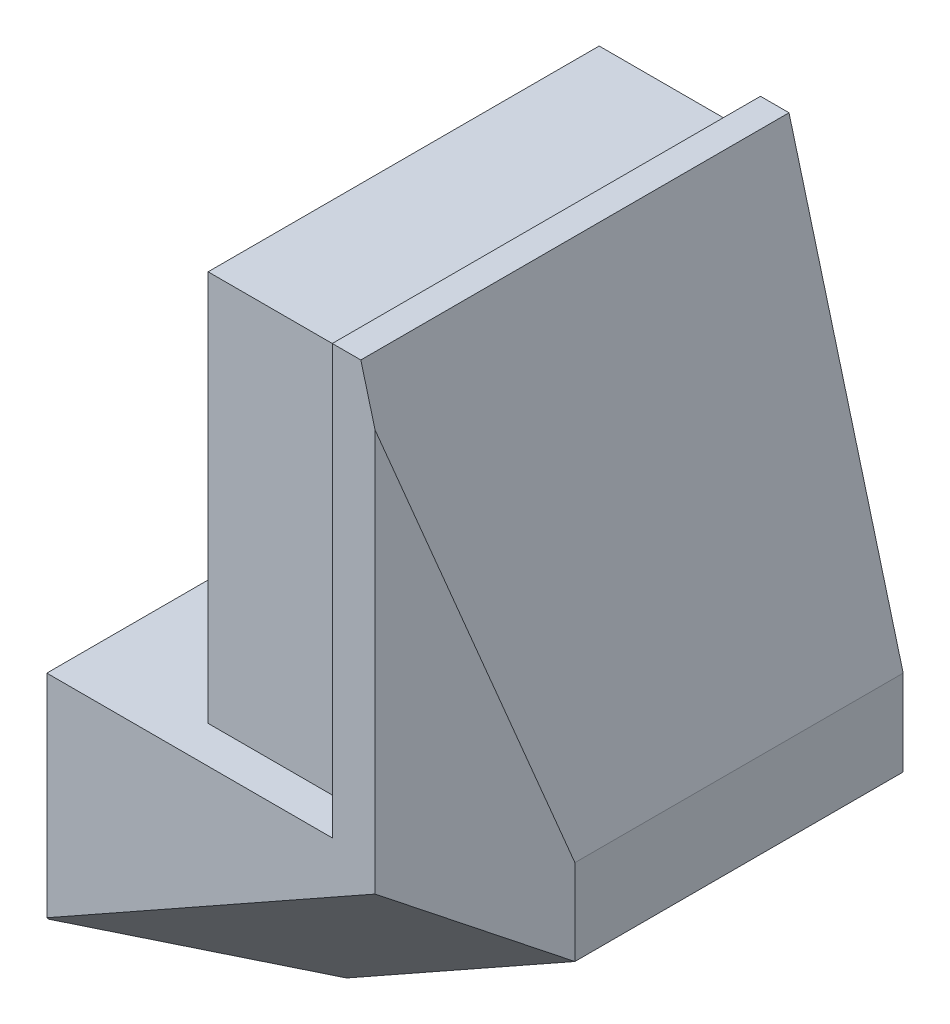
from build123d import *

# Parameters (mm, degrees)
RESSALTO_EXTRUS_O1_DEPTH = 30
ESBO_O2_R                = 5
CORTE_EXTRUS_O1_DEPTH    = 6
CHANFRO1_SIZE            = 7
ESBO_O3_R                = 2.75
CORTE_EXTRUS_O2_DEPTH    = 54.1130869
ESBO_O4_W                = 27.4
ESBO_O4_H                = 27.4
RESSALTO_EXTRUS_O2_DEPTH = 10
ESBO_O5_W                = 24.8
ESBO_O5_H                = 24.8
CORTE_EXTRUS_O3_DEPTH    = 12
CORTE_EXTRUS_O3_DRAFT    = -40


with BuildPart() as part:
    # Esboço1 → Ressalto-extrusão1 (new body)
    with BuildSketch(Plane.XY):
        Polygon((0, 0), (0, 30), (2, 30), (10, 0), (10, -6), (-6, -15), (-20, -15), (-20, 0), align=None)
    extrude(amount=RESSALTO_EXTRUS_O1_DEPTH)

    # Esboço2 → Corte-extrusão1 (cut)
    with BuildSketch(Plane.XZ.offset(15)):
        with Locations(Location((-12.5, 15, 0), (0, 0, 270))):
            Circle(ESBO_O2_R)
    extrude(amount=-CORTE_EXTRUS_O1_DEPTH, mode=Mode.SUBTRACT)

    # Chanfro1
    chanfro1_edges = [part.edges().sort_by_distance(p)[0] for p in [
        (2, -10.5, 30),
        (10, -3, 30),
    ]]
    chamfer(chanfro1_edges, length=CHANFRO1_SIZE)

    # Esboço3 → Corte-extrusão2 (cut, through all)
    with BuildSketch(Plane.XZ.offset(9)):
        with Locations(Location((-12.5, 15, 0), (0, 0, 270))):
            Circle(ESBO_O3_R)
    extrude(amount=-CORTE_EXTRUS_O2_DEPTH, mode=Mode.SUBTRACT)

    # Esboço4 → Ressalto-extrusão2 (add)
    with BuildSketch(Plane.ZY):
        with Locations((15, 15)):
            Rectangle(ESBO_O4_W, ESBO_O4_H)
    extrude(amount=RESSALTO_EXTRUS_O2_DEPTH)


with BuildPart() as corte_extrus_o3_tool:
    # Esboço5 → Corte-extrusão3 (with draft: the straight prism first)
    with BuildSketch(Plane.ZY.offset(10)):
        with Locations((15, 15)):
            Rectangle(ESBO_O5_W, ESBO_O5_H)
    extrude(amount=-CORTE_EXTRUS_O3_DEPTH)
    # Corte-extrusão3: the draft: its side faces are tilted about the plane it starts from
    corte_extrus_o3_sides = [corte_extrus_o3_tool.faces().sort_by_distance(p)[0] for p in [
        (-4, 27.4, 15),
        (-4, 15, 2.6),
        (-4, 2.6, 15),
        (-4, 15, 27.4),
    ]]
    draft(corte_extrus_o3_sides, Plane.ZY.offset(10), CORTE_EXTRUS_O3_DRAFT)


with BuildPart() as part_1:
    add(part.part)

    # Corte-extrusão3: cut by corte_extrus_o3_tool
    add(corte_extrus_o3_tool.part, mode=Mode.SUBTRACT)


solid = part_1.part
